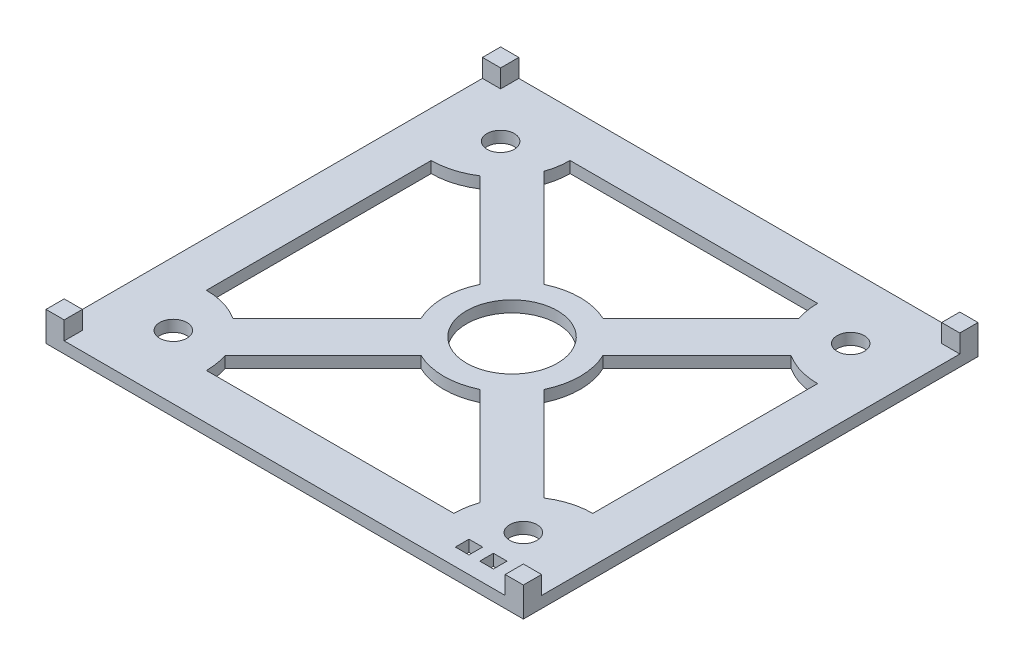
from build123d import *

# Parameters (mm, degrees)
SKETCH1_W           = 105
SKETCH1_H           = 100
BOSS_EXTRUDE1_DEPTH = 2.5
SKETCH3_W           = 4
SKETCH3_H           = 4
BOSS_EXTRUDE2_DEPTH = 4
SKETCH5_W           = 85
SKETCH5_H           = 80
CUT_EXTRUDE2_DEPTH  = 4
SKETCH6_R           = 15
BOSS_EXTRUDE3_DEPTH = 2.5
SKETCH7_W           = 5
SKETCH7_H           = 5
CUT_EXTRUDE3_DEPTH  = 2.5
BOSS_EXTRUDE4_DEPTH = 2.5
EXTRUDE_THIN2_DEPTH = 2.5
SKETCH10_R          = 3
CUT_EXTRUDE5_DEPTH  = 2.5
SKETCH11_W          = 3
SKETCH11_H          = 3
CUT_EXTRUDE6_DEPTH  = 2.5
SKETCH12_R          = 10
CUT_EXTRUDE7_DEPTH  = 10


with BuildPart() as part:
    # Sketch1 → Boss-Extrude1 (new body)
    with BuildSketch(Plane(origin=(0, 0, 0), x_dir=(1, 0, 0), z_dir=(0, 1, 0))):
        Rectangle(SKETCH1_W, SKETCH1_H)
    extrude(amount=BOSS_EXTRUDE1_DEPTH)

    # Sketch3 → Boss-Extrude2 (add)
    with BuildSketch(Plane(origin=(0, 2.5, 0), x_dir=(1, 0, 0), z_dir=(0, 1, 0))):
        with Locations((-50.5, 48)):
            Rectangle(SKETCH3_W, SKETCH3_H)
        with Locations((50.5, 48)):
            Rectangle(SKETCH3_W, SKETCH3_H)
        with Locations((50.5, -48)):
            Rectangle(SKETCH3_W, SKETCH3_H)
        with Locations((-50.5, -48)):
            Rectangle(SKETCH3_W, SKETCH3_H)
    extrude(amount=BOSS_EXTRUDE2_DEPTH)

    # Sketch5 → Cut-Extrude2 (cut)
    with BuildSketch(Plane(origin=(0, 2.5, 0), x_dir=(1, 0, 0), z_dir=(0, 1, 0))):
        Rectangle(SKETCH5_W, SKETCH5_H)
    extrude(amount=-CUT_EXTRUDE2_DEPTH, mode=Mode.SUBTRACT)

    # Sketch8 → Boss-Extrude4 (add)
    with BuildSketch(Plane(origin=(0, 2.5, 0), x_dir=(1, 0, 0), z_dir=(0, 1, 0))):
        with BuildLine():
            Line((-42.5, -40), (-27.220069463, -40))
            ThreePointArc((-27.220069463, -40), (-31.695457502, -29.195457502), (-42.5, -24.720069463))
            Line((-42.5, -24.720069463), (-42.5, -40))
        make_face()
        with BuildLine():
            ThreePointArc((-42.5, 24.720069463), (-31.695457502, 29.195457502), (-27.220069463, 40))
            Line((-27.220069463, 40), (-42.5, 40))
            Line((-42.5, 40), (-42.5, 24.720069463))
        make_face()
        with BuildLine():
            Line((42.5, 40), (27.220069463, 40))
            ThreePointArc((27.220069463, 40), (31.695457502, 29.195457502), (42.5, 24.720069463))
            Line((42.5, 24.720069463), (42.5, 40))
        make_face()
        with BuildLine():
            ThreePointArc((42.5, -24.720069463), (31.695457502, -29.195457502), (27.220069463, -40))
            Line((27.220069463, -40), (42.5, -40))
            Line((42.5, -40), (42.5, -24.720069463))
        make_face()
    extrude(amount=-BOSS_EXTRUDE4_DEPTH)



with BuildPart() as body_2:
    # Sketch6 → Boss-Extrude3 (new body)
    with BuildSketch(Plane(origin=(0, 2.5, 0), x_dir=(1, 0, 0), z_dir=(0, 1, 0))):
        with Locations(Location((0, 0, 0), (0, 0, 270))):
            Circle(SKETCH6_R)
    extrude(amount=-BOSS_EXTRUDE3_DEPTH)

    # Sketch7 → Cut-Extrude3 (cut)
    with BuildSketch(Plane(origin=(0, 2.5, 0), x_dir=(1, 0, 0), z_dir=(0, 1, 0))):
        Rectangle(SKETCH7_W, SKETCH7_H)
    extrude(amount=-CUT_EXTRUDE3_DEPTH, mode=Mode.SUBTRACT)


with BuildPart() as part_1:
    add(part.part)

    add(body_2.part)  # Extrude-Thin2 merges body 2
    # Sketch9 → Extrude-Thin2 (add)
    with BuildSketch(Plane(origin=(0, 2.5, 0), x_dir=(1, 0, 0), z_dir=(0, 1, 0))):
        Polygon((-1.035533906, -6.035533906), (34.46870341, -41.539771222), (41.539771222, -34.46870341), (6.035533906, 1.035533906), align=None)
        Polygon((-11.285533906, -4.214466094), (-41.539771222, -34.46870341), (-34.46870341, -41.539771222), (-4.214466094, -11.285533906), align=None)
        Polygon((11.285533906, 4.214466094), (41.539771222, 34.46870341), (34.46870341, 41.539771222), (4.214466094, 11.285533906), align=None)
        Polygon((-4.214466094, 11.285533906), (-34.46870341, 41.539771222), (-41.539771222, 34.46870341), (-11.285533906, 4.214466094), align=None)
    extrude(amount=-EXTRUDE_THIN2_DEPTH)

    # Sketch10 → Cut-Extrude5 (cut)
    with BuildSketch(Plane(origin=(0, 2.5, 0), x_dir=(1, 0, 0), z_dir=(0, 1, 0))):
        with Locations(Location((38.5, 36, 0), (0, 0, 270))):
            Circle(SKETCH10_R)
        with Locations(Location((-38.5, 36, 0), (0, 0, 90))):
            Circle(SKETCH10_R)
        with Locations(Location((38.5, -36, 0), (0, 0, 90))):
            Circle(SKETCH10_R)
        with Locations(Location((-38.5, -36, 0), (0, 0, 270))):
            Circle(SKETCH10_R)
    extrude(amount=-CUT_EXTRUDE5_DEPTH, mode=Mode.SUBTRACT)

    # Sketch11 → Cut-Extrude6 (cut)
    with BuildSketch(Plane(origin=(0, 2.5, 0), x_dir=(1, 0, 0), z_dir=(0, 1, 0))):
        with Locations((40.657260224, -44.752137111)):
            Rectangle(SKETCH11_W, SKETCH11_H)
        with Locations((35.291405318, -44.752137111)):
            Rectangle(SKETCH11_W, SKETCH11_H)
    extrude(amount=-CUT_EXTRUDE6_DEPTH, mode=Mode.SUBTRACT)

    # Sketch12 → Cut-Extrude7 (cut)
    with BuildSketch(Plane(origin=(0, 2.5, 0), x_dir=(1, 0, 0), z_dir=(0, 1, 0))):
        with Locations(Location((0, 0, 0), (0, 0, 270))):
            Circle(SKETCH12_R)
    extrude(amount=-CUT_EXTRUDE7_DEPTH, mode=Mode.SUBTRACT)


solid = part_1.part
